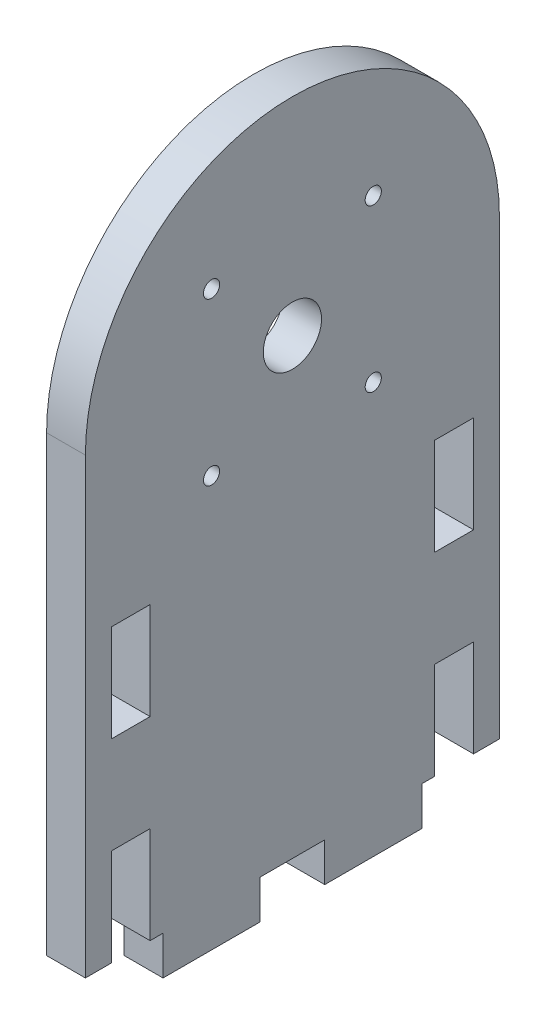
from build123d import *

# Parameters (mm, degrees)
CROQUIS1_R                = 4.5
SALIENTE_EXTRUIR1_DEPTH   = 3
TALADRO_ROSCADO_M3X0_51_D = 2.5
CROQUIS6_W                = 6
CROQUIS6_H                = 15
CORTAR_EXTRUIR1_DEPTH     = 75.491610266
CROQUIS7_W                = 15
CROQUIS7_H                = 6
SALIENTE_EXTRUIR3_DEPTH   = 6


with BuildPart() as part:
    # Croquis1 → Saliente-Extruir1 (new, symmetric)
    with BuildSketch(Plane(origin=(0, 0, 0), x_dir=(0, 0, -1), z_dir=(1, 0, 0))):
        with BuildLine():
            Line((-32, -35), (-32, 35))
            ThreePointArc((-32, 35), (0, 67), (32, 35))
            Line((32, 35), (32, -35))
            Line((32, -35), (-32, -35))
        make_face()
        with Locations((0, 35)):
            Circle(CROQUIS1_R, mode=Mode.SUBTRACT)
    extrude(amount=SALIENTE_EXTRUIR1_DEPTH, both=True)

    # Taladro roscado M3x0.51 (through all)
    with Locations(Plane(origin=(3, 0, 0), x_dir=(0, 0, -1), z_dir=(1, 0, 0))):
        with Locations((12.5, 47.5), (12.5, 22.5), (-12.5, 22.5), (-12.5, 47.5)):
            Hole(TALADRO_ROSCADO_M3X0_51_D / 2)

    # Croquis6 → Cortar-Extruir1 (cut, through all)
    with BuildSketch(Plane(origin=(3, 0, 0), x_dir=(0, 0, -1), z_dir=(1, 0, 0))):
        with Locations((-25, 2.5)):
            Rectangle(CROQUIS6_W, CROQUIS6_H)
        with Locations((-25, -27.5)):
            Rectangle(CROQUIS6_W, CROQUIS6_H)
        with Locations((25, -27.5)):
            Rectangle(CROQUIS6_W, CROQUIS6_H)
        with Locations((25, 2.5)):
            Rectangle(CROQUIS6_W, CROQUIS6_H)
    extrude(amount=-CORTAR_EXTRUIR1_DEPTH, mode=Mode.SUBTRACT)

    # Croquis7 → Saliente-Extruir3 (add, through all)
    with BuildSketch(Plane(origin=(3, 0, 0), x_dir=(0, 0, -1), z_dir=(1, 0, 0))):
        with Locations((-12.5, -38)):
            Rectangle(CROQUIS7_W, CROQUIS7_H)
        with Locations((12.5, -38)):
            Rectangle(CROQUIS7_W, CROQUIS7_H)
    extrude(amount=-SALIENTE_EXTRUIR3_DEPTH)


solid = part.part
